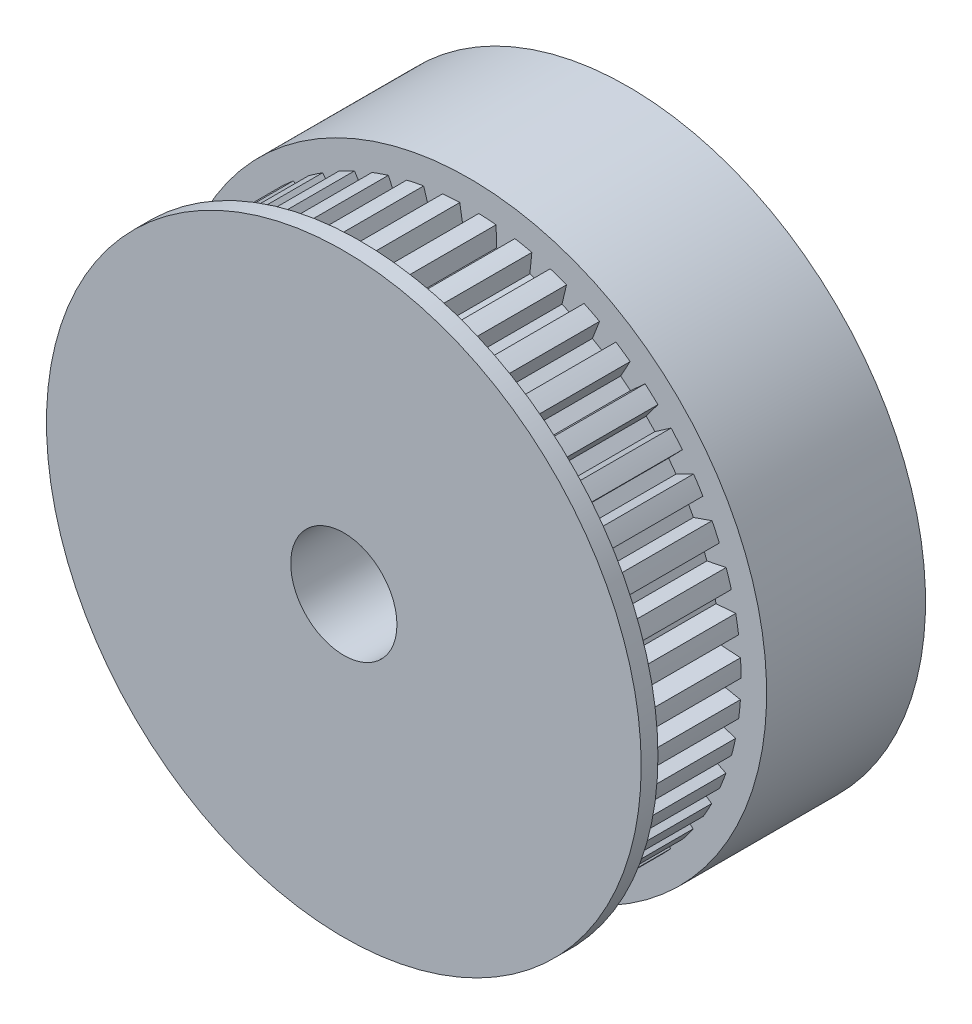
from build123d import *

# Parameters (mm, degrees)
SKETCH3_R           = 16.25
BOSS_EXTRUDE2_DEPTH = 3.25
CUT_EXTRUDE2_DEPTH  = 24.209642393
CIRPATTERN3_COUNT   = 47
SKETCH5_R           = 17.78
BOSS_EXTRUDE3_DEPTH = 9.5
BOSS_EXTRUDE4_START = 1
SKETCH6_R           = 17.78
BOSS_EXTRUDE4_DEPTH = 1
SKETCH7_R           = 3.175
CUT_EXTRUDE3_DEPTH  = 31.35221244


with BuildPart() as part:
    # Sketch3 → Boss-Extrude2 (new, symmetric)
    with BuildSketch(Plane.XY):
        with Locations(Location((0, 0, 0), (0, 0, 180))):
            Circle(SKETCH3_R)
    extrude(amount=BOSS_EXTRUDE2_DEPTH, both=True)

    # Sketch1 → Cut-Extrude2 (cut, symmetric)
    with BuildSketch(Plane.XY):
        Polygon((-0.375, 15.08), (0.375, 15.08), (0.654345854, 16.756075122), (-0.654345854, 16.756075122), align=None)
    cut_extrude2 = extrude(amount=CUT_EXTRUDE2_DEPTH, both=True, mode=Mode.SUBTRACT)

    # CirPattern3: Cut-Extrude2 ×47 about axis
    cirpattern3_axis = Axis((0, 0, 0), (0, 0, 1))
    for i in range(1, CIRPATTERN3_COUNT):
        add(cut_extrude2.rotate(cirpattern3_axis, i * 360 / CIRPATTERN3_COUNT), mode=Mode.SUBTRACT)

    # Sketch5 → Boss-Extrude3 (add)
    with BuildSketch(Plane(origin=(0, 0, -3.25), x_dir=(-1, 0, 0), z_dir=(0, 0, -1))):
        Circle(SKETCH5_R)
    extrude(amount=BOSS_EXTRUDE3_DEPTH)

    # Sketch6 → Boss-Extrude4 (add)
    with BuildSketch(Plane.XY.offset(3.25).offset(BOSS_EXTRUDE4_START)):
        with Locations(Location((0, 0, 0), (0, 0, 180))):
            Circle(SKETCH6_R)
    extrude(amount=-BOSS_EXTRUDE4_DEPTH)

    # Sketch7 → Cut-Extrude3 (cut, through all)
    with BuildSketch(Plane.XY.offset(4.25)):
        Circle(SKETCH7_R)
    extrude(amount=-CUT_EXTRUDE3_DEPTH, mode=Mode.SUBTRACT)


solid = part.part
